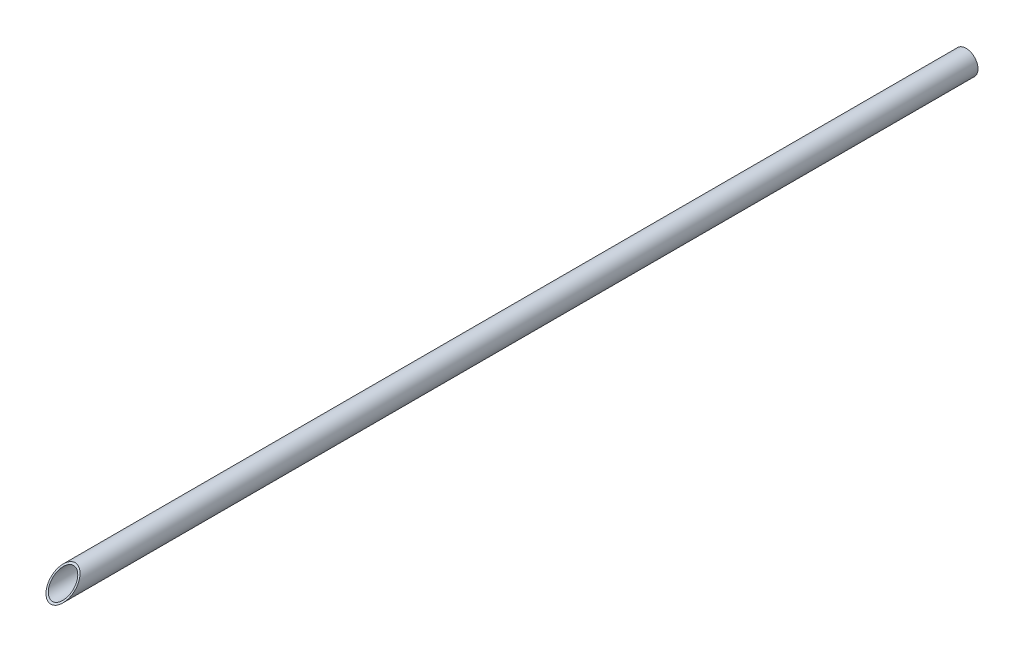
from build123d import *

# Parameters (mm, degrees)
SKETCH1_R               = 19.05
BOSS_EXTRUDE1_DEPTH     = 1524
SHELL1_T                = -2.54
CUT_EXTRUDE1_DEPTH      = 127
CUT_EXTRUDE1_DEPTH_BACK = 127
SKETCH2_OUTSIDE_W       = 1830.99
SKETCH2_OUTSIDE_H       = 345.09


with BuildPart() as part:
    # Sketch1 → Boss-Extrude1 (new body)
    with BuildSketch(Plane.XY):
        Circle(SKETCH1_R)
    extrude(amount=BOSS_EXTRUDE1_DEPTH)

    # Shell1
    shell1_openings = [part.faces().sort_by_distance(p)[0] for p in [
        (0, 0, 0),
    ]]
    offset(amount=SHELL1_T, openings=shell1_openings, kind=Kind.INTERSECTION)

    # Sketch2 outside → Cut-Extrude1 (cut, two sides: drawn at the far end of the back side and taken through both)
    with BuildSketch(Plane(origin=(0, 0, 0), x_dir=(0, 0, -1), z_dir=(1, 0, 0)).offset(-CUT_EXTRUDE1_DEPTH_BACK)):
        with Locations((-762, 0)):
            Rectangle(SKETCH2_OUTSIDE_W, SKETCH2_OUTSIDE_H)
        Polygon((-1524, -76.2), (-1368.114799795, 76.2), (0, 76.2), (0, -76.2), align=None, mode=Mode.SUBTRACT)
    extrude(amount=CUT_EXTRUDE1_DEPTH + CUT_EXTRUDE1_DEPTH_BACK, mode=Mode.SUBTRACT)


solid = part.part
